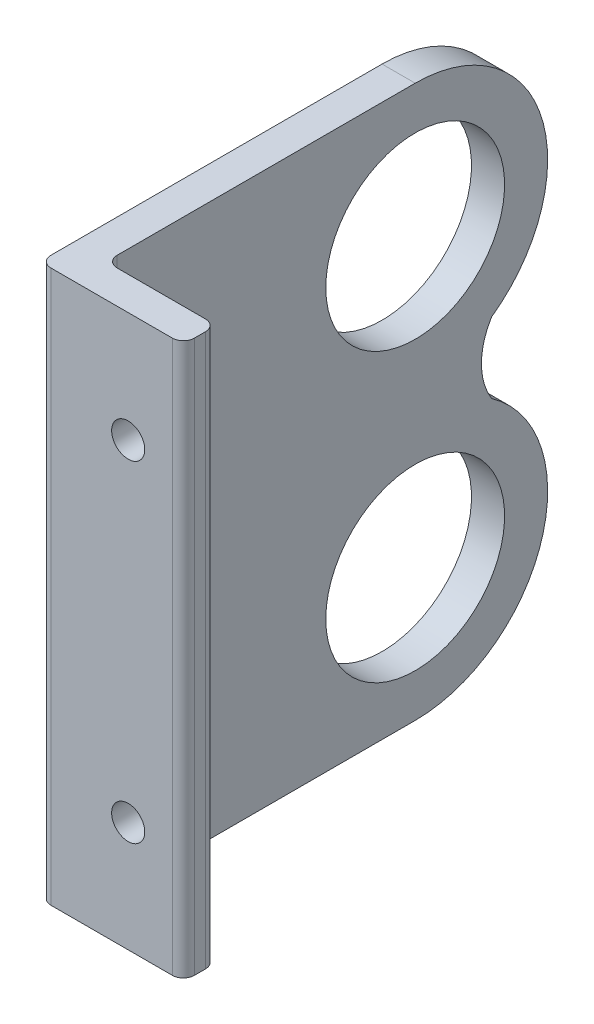
from build123d import *

# Parameters (mm, degrees)
BOSS_EXTRUDE1_DEPTH = 50
SKETCH2_R           = 1.5
CUT_EXTRUDE1_DEPTH  = 3
SKETCH3_R           = 8.1
CUT_EXTRUDE2_DEPTH  = 3


with BuildPart() as part:
    # Sketch1 → Boss-Extrude1 (new body)
    with BuildSketch(Plane(origin=(0, 0, 0), x_dir=(1, 0, 0), z_dir=(0, 1, 0))):
        with BuildLine():
            Line((3.75, 31.3125), (6.75, 31.3125))
            Line((6.75, 31.3125), (6.75, -7.6875))
            ThreePointArc((6.75, -7.6875), (7.042893219, -8.394606781), (7.75, -8.6875))
            Line((7.75, -8.6875), (15.75, -8.6875))
            ThreePointArc((15.75, -8.6875), (16.457106781, -8.980393219), (16.75, -9.6875))
            Line((16.75, -9.6875), (16.75, -10.6875))
            ThreePointArc((16.75, -10.6875), (16.457106781, -11.394606781), (15.75, -11.6875))
            Line((15.75, -11.6875), (4.75, -11.6875))
            ThreePointArc((4.75, -11.6875), (4.042893219, -11.394606781), (3.75, -10.6875))
            Line((3.75, -10.6875), (3.75, 31.3125))
        make_face()
    extrude(amount=BOSS_EXTRUDE1_DEPTH)

    # Sketch2 → Cut-Extrude1 (cut)
    with BuildSketch(Plane.XY.offset(11.6875)):
        with Locations((11.75, 40)):
            Circle(SKETCH2_R)
        with Locations((11.75, 10)):
            Circle(SKETCH2_R)
    extrude(amount=-CUT_EXTRUDE1_DEPTH, mode=Mode.SUBTRACT)

    # Sketch3 → Cut-Extrude2 (cut)
    with BuildSketch(Plane.ZY.offset(-3.75)):
        with BuildLine():
            Line((-31.3125, 0), (-19.3125, 0))
            ThreePointArc((-19.3125, 0), (-27.797781374, 3.514718626), (-31.3125, 12))
            Line((-31.3125, 12), (-31.3125, 0))
        make_face()
        with BuildLine():
            Line((-31.3125, 38), (-31.3125, 12))
            ThreePointArc((-31.3125, 12), (-29.968194023, 17.518712249), (-26.236469186, 21.800951521))
            ThreePointArc((-26.236469186, 21.800951521), (-25.3125, 25), (-26.236469186, 28.199048479))
            ThreePointArc((-26.236469186, 28.199048479), (-29.968194023, 32.481287751), (-31.3125, 38))
        make_face()
        with BuildLine():
            Line((-31.3125, 50), (-31.3125, 38))
            ThreePointArc((-31.3125, 38), (-27.797781374, 46.485281374), (-19.3125, 50))
            Line((-19.3125, 50), (-31.3125, 50))
        make_face()
        with Locations((-19.3125, 12)):
            Circle(SKETCH3_R)
        with Locations((-19.3125, 38)):
            Circle(SKETCH3_R)
    extrude(amount=-CUT_EXTRUDE2_DEPTH, mode=Mode.SUBTRACT)


solid = part.part
